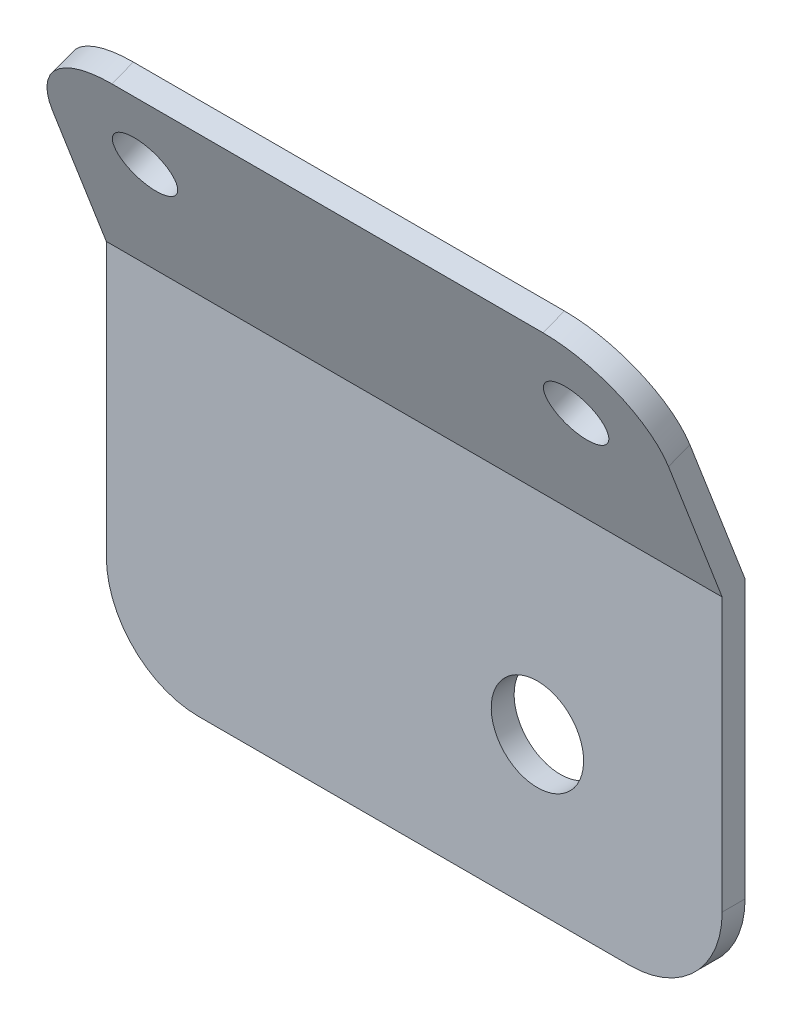
from build123d import *

# Parameters (mm, degrees)
EXTRUDE_THIN1_DEPTH = 31.75
SKETCH2_R           = 4.7625
CUT_EXTRUDE1_DEPTH  = 51.867867683
SKETCH3_R           = 3.175
CUT_EXTRUDE2_DEPTH  = 51.867867683
FILLET1_R           = 9.525


with BuildPart() as part:
    # Sketch1 → Extrude-Thin1 (new, symmetric)
    with BuildSketch(Plane(origin=(0, 0, 0), x_dir=(0, 0, -1), z_dir=(1, 0, 0))):
        Polygon((-9.102545918, 23.712942833), (0, 0), (0, -38.1), (-2.3622, -38.1), (-2.3622, -0.437807892), (-11.307849602, 22.866406063), align=None)
    extrude(amount=EXTRUDE_THIN1_DEPTH, both=True)

    # Sketch2 → Cut-Extrude1 (cut, through all)
    with BuildSketch(Plane(origin=(0, 0, 0), x_dir=(-1, 0, 0), z_dir=(0, 0, -1))):
        with Locations(Location((-12.7, -22.225, 0), (0, 0, 90))):
            Circle(SKETCH2_R)
    extrude(amount=-CUT_EXTRUDE1_DEPTH, mode=Mode.SUBTRACT)

    # Sketch3 → Cut-Extrude2 (cut, through all)
    with BuildSketch(Plane(origin=(0, 0, 0), x_dir=(-1, 0, 0), z_dir=(0, 0.35836794954530177, -0.9335804264972012))):
        with Locations(Location((-22.225, 15.875, 0), (0, 0, 90))):
            Circle(SKETCH3_R)
        with Locations(Location((22.225, 15.875, 0), (0, 0, 90))):
            Circle(SKETCH3_R)
    extrude(amount=-CUT_EXTRUDE2_DEPTH, mode=Mode.SUBTRACT)

    # Fillet1
    fillet1_edges = [part.edges().sort_by_distance(p)[0] for p in [
        (31.75, 23.289674448, 10.20519776),
        (-31.75, 23.289674448, 10.20519776),
        (-31.75, -38.1, 1.1811),
        (31.75, -38.1, 1.1811),
    ]]
    fillet(fillet1_edges, radius=FILLET1_R)


solid = part.part
